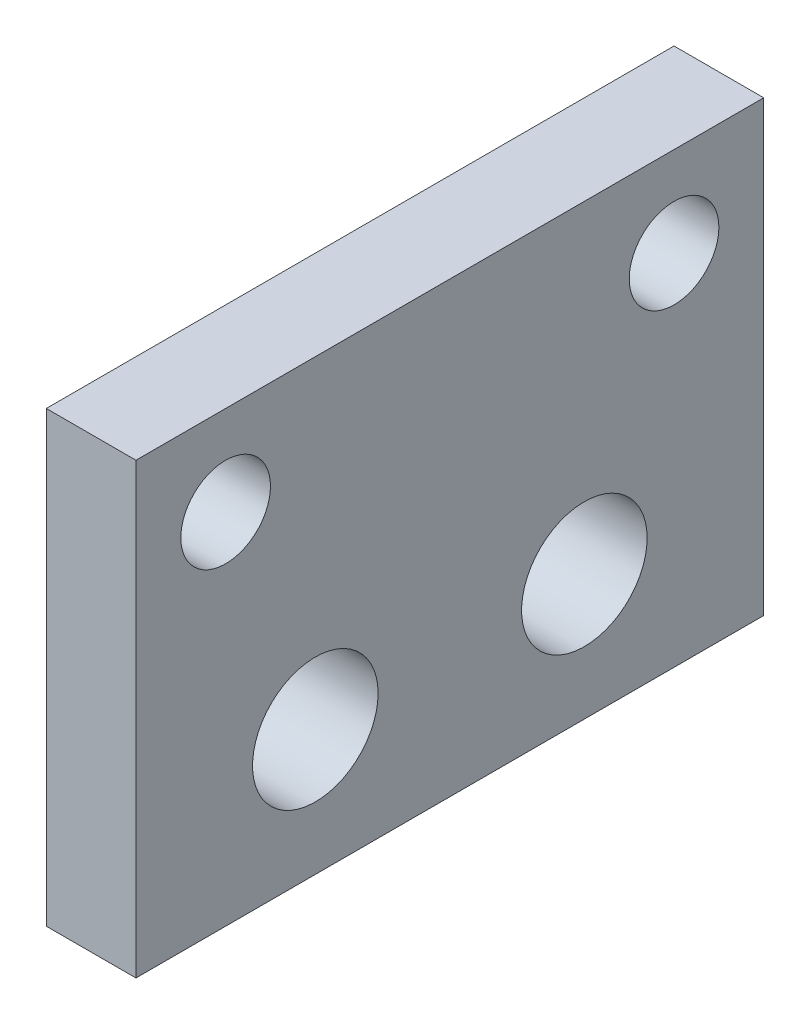
from build123d import *

# Parameters (mm, degrees)
SKETCH1_W           = 35
SKETCH1_H           = 25
BOSS_EXTRUDE1_DEPTH = 5
SKETCH2_R           = 2.5
CUT_EXTRUDE1_DEPTH  = 23.079402166
SKETCH3_R           = 3.5
CUT_EXTRUDE2_DEPTH  = 23.079402166


with BuildPart() as part:
    # Sketch1 → Boss-Extrude1 (new body)
    with BuildSketch(Plane(origin=(0, 0, 0), x_dir=(0, 0, -1), z_dir=(1, 0, 0))):
        Rectangle(SKETCH1_W, SKETCH1_H)
    extrude(amount=BOSS_EXTRUDE1_DEPTH)

    # Sketch2 → Cut-Extrude1 (cut, through all)
    with BuildSketch(Plane(origin=(5, 0, 0), x_dir=(0, 0, -1), z_dir=(1, 0, 0))):
        with Locations((-12.5, 7.5)):
            Circle(SKETCH2_R)
        with Locations((12.5, 7.5)):
            Circle(SKETCH2_R)
    extrude(amount=-CUT_EXTRUDE1_DEPTH, mode=Mode.SUBTRACT)

    # Sketch3 → Cut-Extrude2 (cut, through all)
    with BuildSketch(Plane(origin=(5, 0, 0), x_dir=(0, 0, -1), z_dir=(1, 0, 0))):
        with Locations((-7.5, -5.5)):
            Circle(SKETCH3_R)
        with Locations((7.5, -5.5)):
            Circle(SKETCH3_R)
    extrude(amount=-CUT_EXTRUDE2_DEPTH, mode=Mode.SUBTRACT)


solid = part.part
